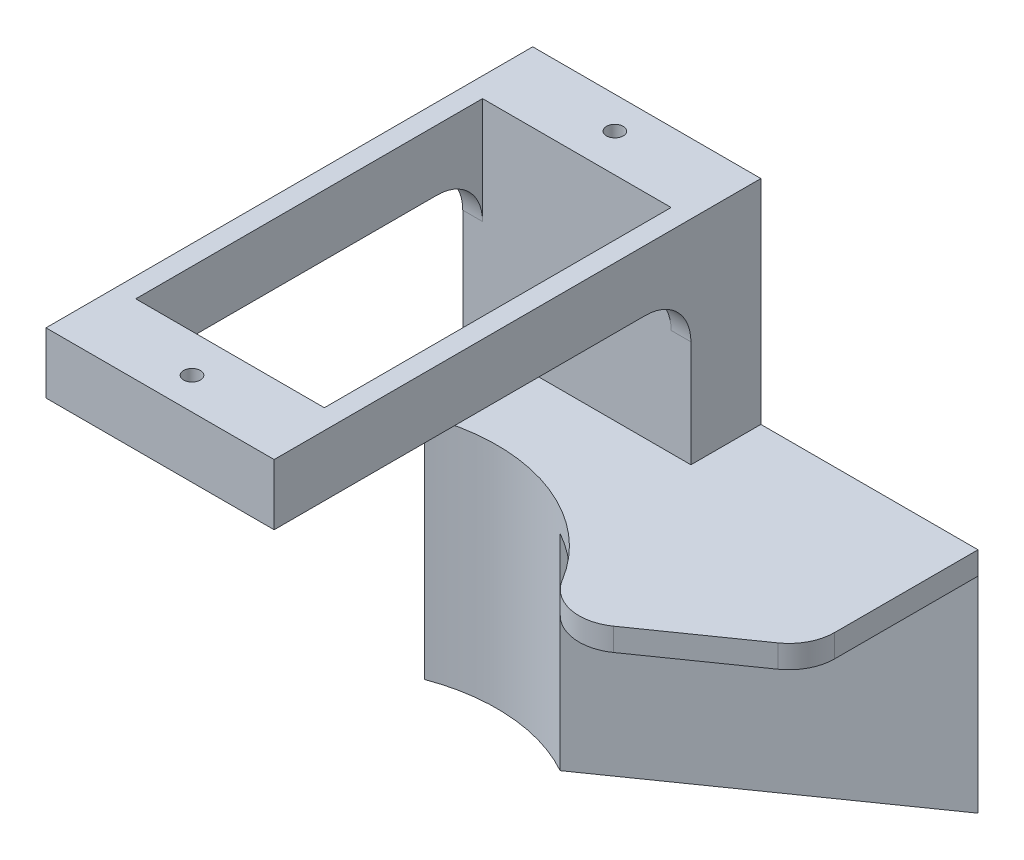
from build123d import *

# Parameters (mm, degrees)
SKETCH1_W               = 15
SKETCH1_H               = 32
SKETCH1_R               = 0.55
SKETCH1_W_2             = 12.4
SKETCH1_H_2             = 22.8
SERVO_MOUNT_PLATE_DEPTH = 4
SKETCH3_R               = 0.55
BOSS_EXTRUDE3_DEPTH     = 25
BOSS_EXTRUDE9_DEPTH     = 15
CUT_EXTRUDE3_START      = 1.5
CUT_EXTRUDE3_DEPTH      = 13.5
FILLET1_R               = 3
BODY_MOVE_COPY1_ANGLE   = 90


with BuildPart() as part:
    # Sketch1 → Servo Mount Plate (new body)
    with BuildSketch(Plane.XY):
        Rectangle(SKETCH1_W, SKETCH1_H)
        with Locations((0, 13.9)):
            Circle(SKETCH1_R, mode=Mode.SUBTRACT)
        with Locations((0, -13.9)):
            Circle(SKETCH1_R, mode=Mode.SUBTRACT)
        Rectangle(SKETCH1_W_2, SKETCH1_H_2, mode=Mode.SUBTRACT)
    extrude(amount=SERVO_MOUNT_PLATE_DEPTH)

    # Sketch3 → Boss-Extrude3 (add)
    # profile 1 of 2: a face of its own
    with BuildSketch(Plane.XY.offset(4)):
        Polygon((6.2, -11.4), (-6.2, -11.4), (-7.5, -11.4), (-7.5, -16), (7.5, -16), (7.5, -11.4), align=None)
        with Locations((0, -13.9)):
            Circle(SKETCH3_R, mode=Mode.SUBTRACT)
    # profile 2 of 2: a face of its own
    with BuildSketch(Plane.XY.offset(4)):
        with Locations((0, -13.9)):
            Circle(SKETCH3_R)
    extrude(amount=BOSS_EXTRUDE3_DEPTH)

    # Sketch5 → Boss-Extrude9 (add)
    with BuildSketch(Plane.XY.offset(14)):
        with BuildLine():
            Line((5.615385478, -4.685808185), (7.5, -6.00542948))
            Line((7.5, -6.00542948), (21.773725966, -16))
            Line((21.773725966, -16), (21.773725966, -5.013028701))
            Line((21.773725966, -5.013028701), (11.126345195, 2.442347577))
            ThreePointArc((11.126345195, 2.442347577), (9.098023831, -1.683915153), (5.615385478, -4.685808185))
        make_face()
        Polygon((21.773725966, -16), (7.5, -6.00542948), (7.5, -11.4), (7.5, -16), align=None)
        with BuildLine():
            Line((7.5, -11.4), (7.5, -6.00542948))
            Line((7.5, -6.00542948), (5.615385478, -4.685808185))
            ThreePointArc((5.615385478, -4.685808185), (0.865900109, -6.117354403), (-4.044697914, -5.415241232))
            Line((-4.044697914, -5.415241232), (-7.5, -11.4))
            Line((-7.5, -11.4), (7.5, -11.4))
        make_face()
    extrude(amount=BOSS_EXTRUDE9_DEPTH)

    # Sketch5<8> → Cut-Extrude3 (cut)
    with BuildSketch(Plane.XY.offset(14).offset(CUT_EXTRUDE3_START)):
        with BuildLine():
            Line((5.615385478, -4.685808185), (7.5, -6.00542948))
            Line((7.5, -6.00542948), (21.773725966, -16))
            Line((21.773725966, -16), (21.773725966, -5.013028701))
            Line((21.773725966, -5.013028701), (11.126345195, 2.442347577))
            ThreePointArc((11.126345195, 2.442347577), (9.098023831, -1.683915153), (5.615385478, -4.685808185))
        make_face()
    extrude(amount=CUT_EXTRUDE3_DEPTH, mode=Mode.SUBTRACT)

    # Fillet1
    fillet1_edges = [part.edges().sort_by_distance(p)[0] for p in [
        (6.85, -11.4, 4),
        (-6.85, -11.4, 4),
        (11.126345195, 2.442347577, 14.75),
        (21.773725966, -5.013028701, 14.75),
    ]]
    fillet(fillet1_edges, radius=FILLET1_R)


with BuildPart() as part_1:
    # Body-Move/Copy1: moved
    add(part.part.rotate(Axis((0, 0, 14.5), (1, 0, 0)), BODY_MOVE_COPY1_ANGLE))


solid = part_1.part
